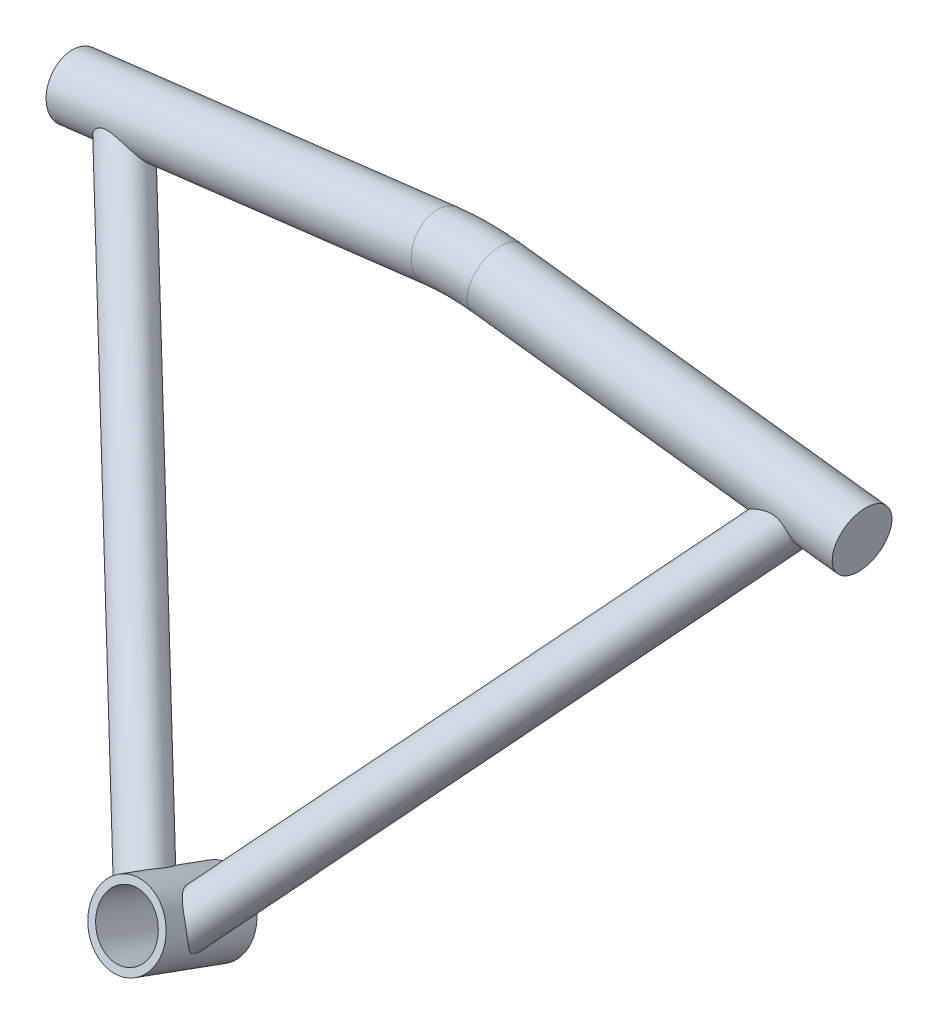
from build123d import *

# Parameters (mm, degrees)
SKETCH1_R               = 15.875
BOSS_EXTRUDE1_DEPTH     = 20.701
SWEEP1_PROFILE_R        = 9.525
SWEEP2_PROFILE_R        = 9.525
CUT_EXTRUDE2_REACH      = 378.511
SKETCH36_R              = 7.9375
CUT_EXTRUDE3_REACH      = 378.511
CUT_EXTRUDE3_END_RADIUS = 15.875
SKETCH37_R              = 7.9375
SKETCH77_R              = 15.875
BOSS_EXTRUDE2_DEPTH     = 41.402
CUT_EXTRUDE1_REACH      = 259.443
SKETCH2_R               = 12.7
SWEEP3_PROFILE_R        = 12.7


with BuildPart() as part:
    # Sketch1 → Boss-Extrude1 (new, symmetric)
    with BuildSketch(Plane(origin=(0, 0, 0), x_dir=(1, 0, 0), z_dir=(0, 0.34202014332566943, 0.9396926207859081))):
        with Locations(Location((0, 0, 0), (0, 0, 270))):
            Circle(SKETCH1_R)
    extrude(amount=BOSS_EXTRUDE1_DEPTH, both=True)

    # Sweep1: sweep along a path in Sketch4
    with BuildLine(Plane(origin=(0, 3.105618632, 3.835119618), x_dir=(1, 0, 0), z_dir=(0, 0.6293203910498386, 0.7771459614569699))) as sweep1_path:
        Line((-5.08, -3.996184483), (-144.274297532, 202.367848077))
    # Sweep1 profile (on start of the path) → Sweep1 (sweep)
    with BuildSketch(Plane(origin=(-5.08, 0, 6.35), x_dir=(0.7552165772235139, 0.6554753401057895, 0), z_dir=(-0.5591929034707482, 0.6442832014072397, -0.5217302493553473))):
        Circle(SWEEP1_PROFILE_R)
    sweep(path=sweep1_path.line)

    # Sweep2: sweep along a path in Sketch15
    with BuildLine(Plane(origin=(0, 3.105618632, 3.835119618), x_dir=(1, 0, 0), z_dir=(0, 0.6293203910498386, 0.7771459614569699))) as sweep2_path:
        Line((5.08, -3.996184483), (144.274297532, 202.367848077))
    # Sweep2 profile (on start of the path) → Sweep2 (sweep)
    with BuildSketch(Plane(origin=(5.08, 0, 6.35), x_dir=(0.755216577223514, -0.6554753401057893, 0), z_dir=(0.559192903470748, 0.6442832014072398, -0.5217302493553474))):
        Circle(SWEEP2_PROFILE_R)
    sweep(path=sweep2_path.line)

    # Sketch36 → Cut-Extrude2 (cut, up to next)
    with BuildSketch(Plane(origin=(-138.930197918, 160.070687828, -129.622687185), x_dir=(0.8289940269345192, 0.4281015835398337, -0.35985821857722894), z_dir=(-0.5591929034707483, 0.6442832014072397, -0.5217302493553471)), mode=Mode.PRIVATE) as cut_extrude2_sk1:
        with Locations(Location((-6.496389345, -4.868549101, 0), (0, 0, 155.050518422))):
            Circle(SKETCH36_R)
    cut_extrude2_tool1 = extrude(cut_extrude2_sk1.sketch, amount=-CUT_EXTRUDE2_REACH, mode=Mode.PRIVATE) & part.part
    add(cut_extrude2_tool1.solids().sort_by_distance((-144.274298, 160.374974, -123.519094))[0], mode=Mode.SUBTRACT)

    # Cut-Extrude3: up to this cylinder (the profile starts outside it)
    cut_extrude3_end = Plane(origin=(0, -20.937963415, -57.526581693), z_dir=(0, -0.34202014332566943, -0.9396926207859081)) * Cylinder(CUT_EXTRUDE3_END_RADIUS, 789.772, mode=Mode.PRIVATE)
    # Sketch37 → Cut-Extrude3 (cut, up to the surface)
    with BuildSketch(Plane(origin=(138.930197918, 160.070687828, -129.622687185), x_dir=(0.8289940269345193, -0.42810158353983335, 0.3598582185772289), z_dir=(0.5591929034707481, 0.6442832014072395, -0.5217302493553476)), mode=Mode.PRIVATE) as cut_extrude3_sk1:
        with Locations(Location((6.496389345, -4.868549101, 0), (0, 0, 204.949481578))):
            Circle(SKETCH37_R)
    cut_extrude3_tool1 = extrude(cut_extrude3_sk1.sketch, amount=-CUT_EXTRUDE3_REACH, mode=Mode.PRIVATE) - cut_extrude3_end
    add(cut_extrude3_tool1.solids().sort_by_distance((144.274298, 160.374974, -123.519094))[0], mode=Mode.SUBTRACT)

    # Sketch77 → Boss-Extrude2 (add)
    with BuildSketch(Plane(origin=(0, 7.080158987, 19.452576943), x_dir=(1, 0, 0), z_dir=(0, 0.34202014332566943, 0.9396926207859082))):
        with Locations(Location((0, 0, 0), (0, 0, 270))):
            Circle(SKETCH77_R)
    extrude(amount=-BOSS_EXTRUDE2_DEPTH)

    # Sketch2 → Cut-Extrude1 (cut, up to next)
    with BuildSketch(Plane(origin=(0, -7.080158987, -19.452576943), x_dir=(-1, 0, 0), z_dir=(0, -0.34202014332566943, -0.9396926207859081)), mode=Mode.PRIVATE) as cut_extrude1_sk1:
        with Locations(Location((0, 0, 0), (0, 0, 90))):
            Circle(SKETCH2_R)
    cut_extrude1_tool1 = extrude(cut_extrude1_sk1.sketch, amount=-CUT_EXTRUDE1_REACH, mode=Mode.PRIVATE) & part.part
    add(cut_extrude1_tool1.solids().sort_by_distance((0, -7.080159, -19.452577))[0], mode=Mode.SUBTRACT)

    # Sweep3: sweep along a path in Sketch40
    with BuildLine(Plane(origin=(-106.934, 0, -127), x_dir=(1, 0, 0), z_dir=(0, 0, 1))) as sweep3_path:
        Line((-61.368998352, 161.203949912), (94.970004728, 180.126595496))
        ThreePointArc((94.970004728, 180.126595496), (106.934, 180.848), (118.897995272, 180.126595496))
        Line((118.897995272, 180.126595496), (275.236998352, 161.203949912))
    # Sweep3 profile (on start of the path) → Sweep3 (sweep)
    with BuildSketch(Plane(origin=(-168.302998352, 161.203949912, -127), x_dir=(-0.12015903977427271, 0.9927546550686756, 0), z_dir=(0.9927546550686756, 0.12015903977427271, 0))):
        Circle(SWEEP3_PROFILE_R)
    sweep(path=sweep3_path.line)


solid = part.part
